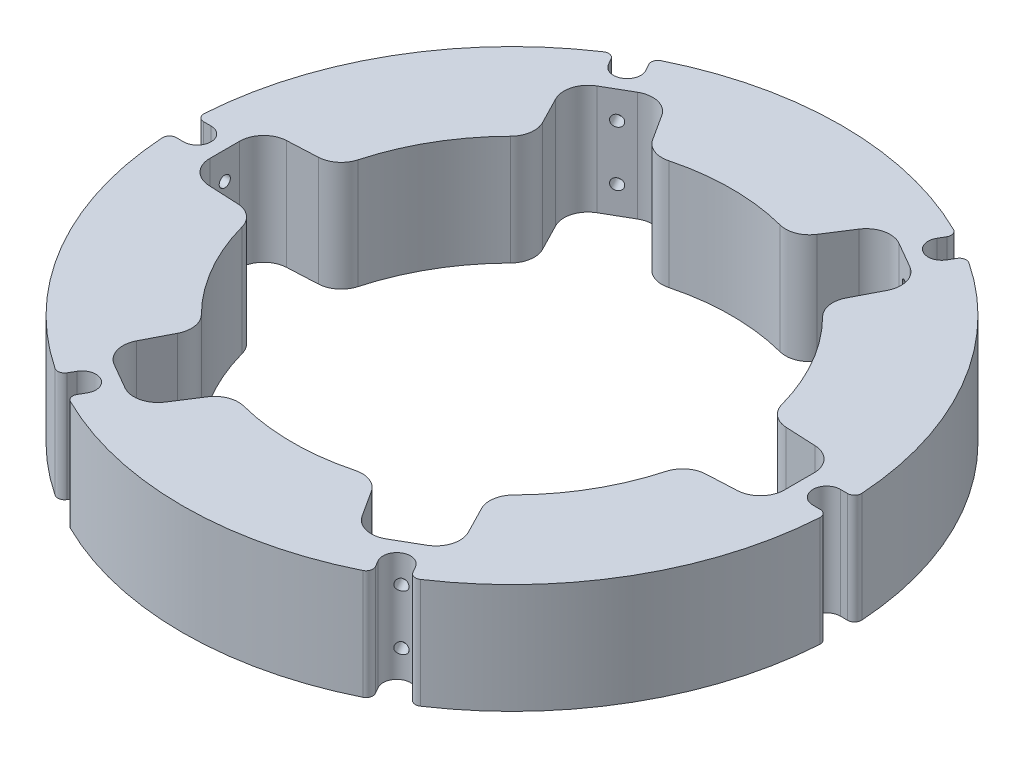
from build123d import *

# Parameters (mm, degrees)
SKETCH1_R                 = 76.2
SKETCH1_R_2               = 50.8
BOSS_EXTRUDE1_DEPTH       = 12.7
CUT_EXTRUDE1_START        = -12.7
CUT_EXTRUDE1_DEPTH        = 12.7
CUT_EXTRUDE2_DEPTH        = 109.508847566
F_5_40_TAPPED_HOLE1_D     = 2.5781
F_5_40_TAPPED_HOLE1_DEPTH = 9.712825433
FILLET1_R                 = 1.5875
FILLET2_R                 = 5.55625
CIRPATTERN1_COUNT         = 6
FILLET1_OF_CIRPATTERN1_R  = 1.5875
FILLET2_OF_CIRPATTERN1_R  = 5.55625


with BuildPart() as part:
    # Sketch1 → Boss-Extrude1 (new body)
    with BuildSketch(Plane(origin=(0, 0, 0), x_dir=(1, 0, 0), z_dir=(0, 1, 0))):
        with Locations(Location((0, 0, 0), (0, 0, 270))):
            Circle(SKETCH1_R)
        with Locations(Location((0, 0, 0), (0, 0, 270))):
            Circle(SKETCH1_R_2, mode=Mode.SUBTRACT)
    extrude(amount=-BOSS_EXTRUDE1_DEPTH)

    # Sketch3 → Cut-Extrude1 (cut)
    with BuildSketch(Plane(origin=(0, -12.7, 0), x_dir=(-1, 0, 0), z_dir=(0, -1, 0)).offset(CUT_EXTRUDE1_START)):
        with BuildLine():
            Line((-76.133825433, 3.175), (-72.771, 3.175))
            ThreePointArc((-72.771, 3.175), (-69.596, 0), (-72.771, -3.175))
            Line((-72.771, -3.175), (-76.133825433, -3.175))
            ThreePointArc((-76.133825433, -3.175), (-76.2, 0), (-76.133825433, 3.175))
        make_face()
    cut_extrude1 = extrude(amount=CUT_EXTRUDE1_DEPTH, mode=Mode.SUBTRACT)

    # Sketch4 → Cut-Extrude2 (cut, through all)
    with BuildSketch(Plane(origin=(0, -12.7, 0), x_dir=(-1, 0, 0), z_dir=(0, -1, 0))):
        Polygon((-66.421, 8.73125), (-66.421, -8.73125), (-49.899041824, -9.525), (-49.899041824, 9.525), align=None)
    cut_extrude2 = extrude(amount=-CUT_EXTRUDE2_DEPTH, mode=Mode.SUBTRACT)

    # #5-40 Tapped Hole1
    with Locations(Plane.ZY.offset(-66.421)):
        with Locations((0, -6.35)):
            f_5_40_tapped_hole1 = Hole(F_5_40_TAPPED_HOLE1_D / 2, depth=F_5_40_TAPPED_HOLE1_DEPTH)

    # Fillet1
    fillet1_edges = [part.edges().sort_by_distance(p)[0] for p in [
        (76.133825433, -6.35, 3.175),
        (76.133825433, -6.35, -3.175),
    ]]
    fillet(fillet1_edges, radius=FILLET1_R)

    # Fillet2
    fillet2_edges = [part.edges().sort_by_distance(p)[0] for p in [
        (66.421, -6.35, -8.73125),
        (49.899041824, -6.35, -9.525),
        (49.899041824, -6.35, 9.525),
        (66.421, -6.35, 8.73125),
    ]]
    fillet(fillet2_edges, radius=FILLET2_R)

    # CirPattern1: Cut-Extrude1, Cut-Extrude2, #5-40 Tapped Hole1 ×6 about axis
    cirpattern1_axis = Axis((0, 0, 0), (0, 1, 0))
    add([cut_extrude1.rotate(cirpattern1_axis, i * 360 / CIRPATTERN1_COUNT) for i in range(1, CIRPATTERN1_COUNT)], mode=Mode.SUBTRACT)
    add([cut_extrude2.rotate(cirpattern1_axis, i * 360 / CIRPATTERN1_COUNT) for i in range(1, CIRPATTERN1_COUNT)], mode=Mode.SUBTRACT)
    add([f_5_40_tapped_hole1.rotate(cirpattern1_axis, i * 360 / CIRPATTERN1_COUNT) for i in range(1, CIRPATTERN1_COUNT)], mode=Mode.SUBTRACT)

    # Fillet1 of CirPattern1
    fillet1_of_cirpattern1_edges = [part.edges().sort_by_distance(p)[0] for p in [
        (40.816543373, -6.35, -64.346326912),
        (35.317282059, -6.35, -67.521326912),
        (-35.317282059, -6.35, -67.521326912),
        (-40.816543373, -6.35, -64.346326912),
        (-76.133825433, -6.35, -3.175),
        (-76.133825433, -6.35, 3.175),
        (-40.816543373, -6.35, 64.346326912),
        (-35.317282059, -6.35, 67.521326912),
        (35.317282059, -6.35, 67.521326912),
        (40.816543373, -6.35, 64.346326912),
    ]]
    fillet(fillet1_of_cirpattern1_edges, radius=FILLET1_OF_CIRPATTERN1_R)

    # Fillet2 of CirPattern1
    fillet2_of_cirpattern1_edges = [part.edges().sort_by_distance(p)[0] for p in [
        (25.649015693, -6.35, -61.887898345),
        (16.700628941, -6.35, -47.976337844),
        (33.198412883, -6.35, -38.451337844),
        (40.771984307, -6.35, -53.156648345),
        (-40.771984307, -6.35, -53.156648345),
        (-33.198412883, -6.35, -38.451337844),
        (-16.700628941, -6.35, -47.976337844),
        (-25.649015693, -6.35, -61.887898345),
        (-66.421, -6.35, 8.73125),
        (-49.899041824, -6.35, 9.525),
        (-49.899041824, -6.35, -9.525),
        (-66.421, -6.35, -8.73125),
        (-25.649015693, -6.35, 61.887898345),
        (-16.700628941, -6.35, 47.976337844),
        (-33.198412883, -6.35, 38.451337844),
        (-40.771984307, -6.35, 53.156648345),
        (40.771984307, -6.35, 53.156648345),
        (33.198412883, -6.35, 38.451337844),
        (16.700628941, -6.35, 47.976337844),
        (25.649015693, -6.35, 61.887898345),
    ]]
    fillet(fillet2_of_cirpattern1_edges, radius=FILLET2_OF_CIRPATTERN1_R)

    # Mirror3: part across plane


with BuildPart() as part_1:
    add(part.part)
    add(part.part.mirror(Plane.ZX))


solid = part_1.part
